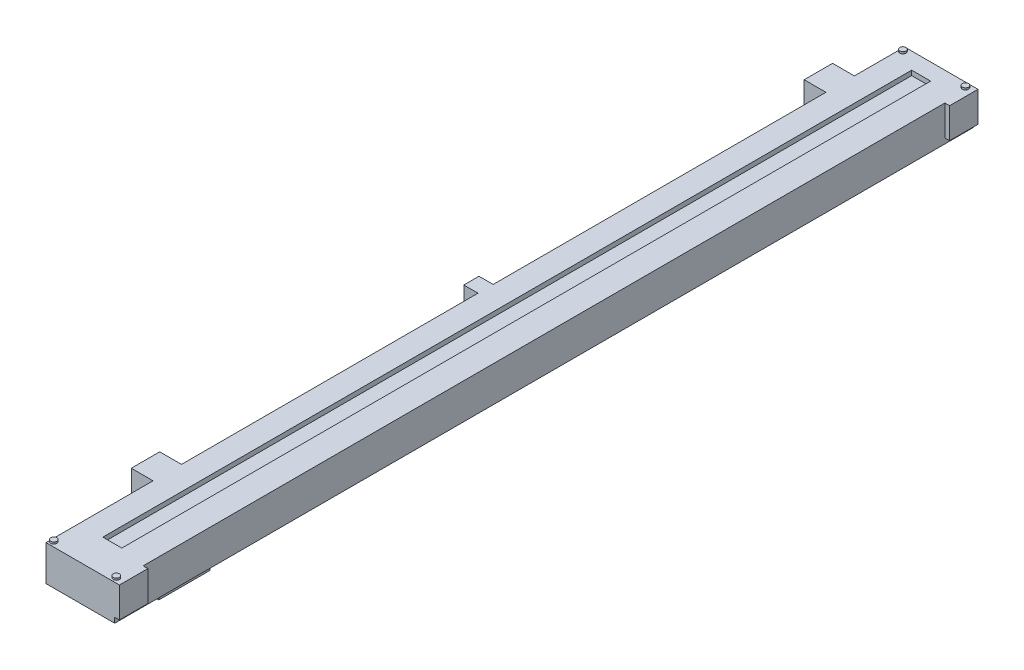
from build123d import *

# Parameters (mm, degrees)
SKETCH1_W           = 18.415
SKETCH1_H           = 230.1875
BOSS_EXTRUDE1_DEPTH = 9.525
SKETCH2_W           = 5.08
SKETCH2_H           = 216.8525
CUT_EXTRUDE1_DEPTH  = 1.27
SKETCH3_W           = 5.842
SKETCH3_H           = 7.62
SKETCH3_W_2         = 3.81
SKETCH3_H_2         = 4.064
SKETCH3_W_3         = 1.27
BOSS_EXTRUDE2_DEPTH = 8.128
SKETCH4_R           = 0.8255
BOSS_EXTRUDE3_DEPTH = 0.508
SKETCH5_W           = 5.08
SKETCH5_H           = 13.716
BOSS_EXTRUDE4_DEPTH = 2.794


with BuildPart() as part:
    # Sketch1 → Boss-Extrude1 (new body)
    with BuildSketch(Plane(origin=(0, 0, 0), x_dir=(1, 0, 0), z_dir=(0, 1, 0))):
        Rectangle(SKETCH1_W, SKETCH1_H)
    extrude(amount=BOSS_EXTRUDE1_DEPTH)

    # Sketch2 → Cut-Extrude1 (cut)
    with BuildSketch(Plane(origin=(0, 9.525, 0), x_dir=(1, 0, 0), z_dir=(0, 1, 0))):
        with Locations((-0.3175, 2.2225)):
            Rectangle(SKETCH2_W, SKETCH2_H)
    extrude(amount=-CUT_EXTRUDE1_DEPTH, mode=Mode.SUBTRACT)

    # Sketch3 → Boss-Extrude2 (add)
    with BuildSketch(Plane(origin=(0, 9.525, 0), x_dir=(1, 0, 0), z_dir=(0, 1, 0))):
        with Locations((-12.1285, 97.82175)):
            Rectangle(SKETCH3_W, SKETCH3_H)
        with Locations((-11.1125, 2.76225)):
            Rectangle(SKETCH3_W_2, SKETCH3_H_2)
        with Locations((-12.1285, -82.58175)):
            Rectangle(SKETCH3_W, SKETCH3_H)
        with Locations((9.8425, 111.28375)):
            Rectangle(SKETCH3_W_3, SKETCH3_H)
        with Locations((9.8425, -111.28375)):
            Rectangle(SKETCH3_W_3, SKETCH3_H)
    extrude(amount=-BOSS_EXTRUDE2_DEPTH)

    # Sketch4 → Boss-Extrude3 (add)
    with BuildSketch(Plane(origin=(0, 9.525, 0), x_dir=(1, 0, 0), z_dir=(0, 1, 0))):
        with Locations(Location((-8.382, 113.82375, 0), (0, 0, 180))):
            Circle(SKETCH4_R)
        with Locations(Location((8.382, 113.82375, 0), (0, 0, 270))):
            Circle(SKETCH4_R)
        with Locations(Location((8.382, -113.82375, 0), (0, 0, 270))):
            Circle(SKETCH4_R)
        with Locations(Location((-8.382, -113.82375, 0), (0, 0, 180))):
            Circle(SKETCH4_R)
    extrude(amount=BOSS_EXTRUDE3_DEPTH)

    # Sketch5 → Boss-Extrude4 (add)
    with BuildSketch(Plane.XZ):
        with Locations((4.3815, 94.11335)):
            Rectangle(SKETCH5_W, SKETCH5_H)
    extrude(amount=BOSS_EXTRUDE4_DEPTH)


solid = part.part
